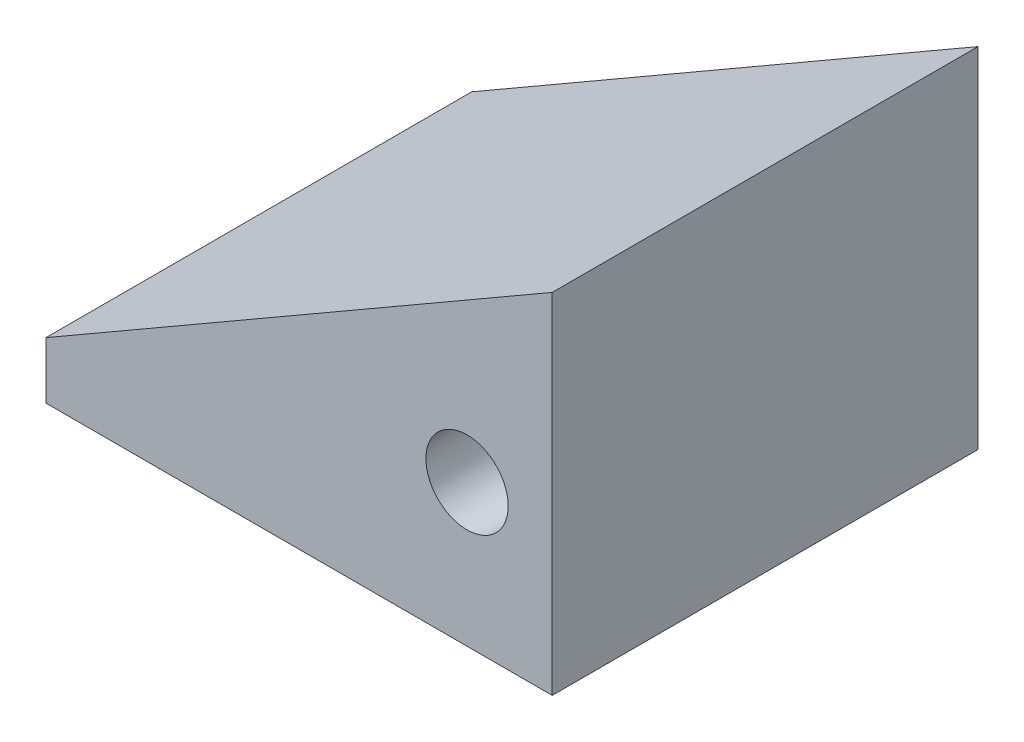
from build123d import *

# Parameters (mm, degrees)
RESSALTO_EXTRUS_O1_DEPTH   = 15
CORTE_EXTRUS_O1_DEPTH      = 26.475478406
CORTE_EXTRUS_O1_DEPTH_BACK = 26.475478406
ESBO_O2_R                  = 1.45


with BuildPart() as part:
    # Esboço1 → Ressalto-extrusão1 (new body)
    with BuildSketch(Plane.XY):
        Polygon((0, 0), (17.8325545, 10.295630141), (17.8325545, 0.295630141), (17.8325545, -2), (0, -2), align=None)
    extrude(amount=RESSALTO_EXTRUS_O1_DEPTH)

    # Esboço2 → Corte-extrusão1 (cut, two sides: drawn at the far end of the back side and taken through both)
    with BuildSketch(Plane.XY.offset(15).offset(-CORTE_EXTRUS_O1_DEPTH_BACK)):
        with Locations((14.8325545, 3)):
            Circle(ESBO_O2_R)
    extrude(amount=CORTE_EXTRUS_O1_DEPTH + CORTE_EXTRUS_O1_DEPTH_BACK, mode=Mode.SUBTRACT)


solid = part.part
